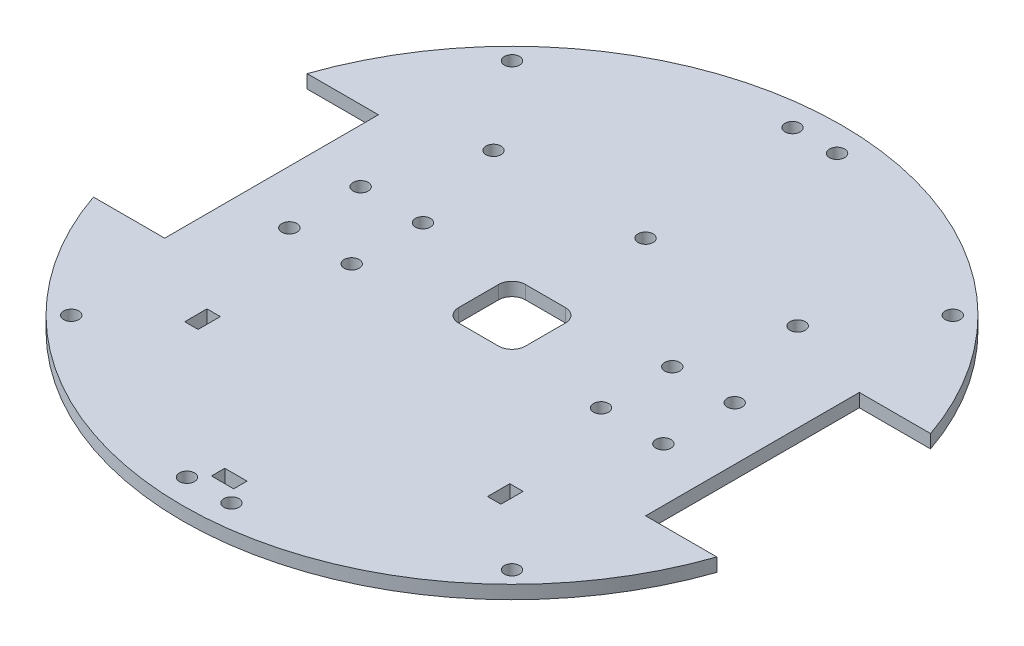
from build123d import *

# Parameters (mm, degrees)
SKETCH_1_R      = 1.7
SKETCH_1_W      = 3
SKETCH_1_H      = 5
SKETCH_1_W_2    = 5
SKETCH_1_H_2    = 3
EXTRUDE_1_DEPTH = 3


with BuildPart() as part:
    # 草图1 → 凸台-拉伸1 (new body)
    with BuildSketch(Plane(origin=(0, 0, 0), x_dir=(1, 0, 0), z_dir=(0, 1, 0))):
        with BuildLine():
            Line((54, 24), (70, 24))
            ThreePointArc((70, 24), (0, 74), (-70, 24))
            Line((-70, 24), (-54, 24))
            Line((-54, 24), (-54, -24))
            Line((-54, -24), (-70, -24))
            ThreePointArc((-70, -24), (0, -74), (70, -24))
            Line((70, -24), (54, -24))
            Line((54, -24), (54, 24))
        make_face()
        with Locations(Location((-49.497474683, -49.497474683, 0), (0, 0, 270))):
            Circle(SKETCH_1_R, mode=Mode.SUBTRACT)
        with Locations(Location((-5, -68, 0), (0, 0, 270))):
            Circle(SKETCH_1_R, mode=Mode.SUBTRACT)
        with Locations(Location((-42, -8, 0), (0, 0, 270))):
            Circle(SKETCH_1_R, mode=Mode.SUBTRACT)
        with Locations((-34, -35.5)):
            Rectangle(SKETCH_1_W, SKETCH_1_H, mode=Mode.SUBTRACT)
        with Locations(Location((-28, -8, 0), (0, 0, 270))):
            Circle(SKETCH_1_R, mode=Mode.SUBTRACT)
        with Locations(Location((5, -68, 0), (0, 0, 270))):
            Circle(SKETCH_1_R, mode=Mode.SUBTRACT)
        with Locations((0, -63.5)):
            Rectangle(SKETCH_1_W_2, SKETCH_1_H_2, mode=Mode.SUBTRACT)
        with Locations(Location((49.497474683, -49.497474683, 0), (0, 0, 270))):
            Circle(SKETCH_1_R, mode=Mode.SUBTRACT)
        with Locations((34, -35.5)):
            Rectangle(SKETCH_1_W, SKETCH_1_H, mode=Mode.SUBTRACT)
        with Locations(Location((28, -8, 0), (0, 0, 270))):
            Circle(SKETCH_1_R, mode=Mode.SUBTRACT)
        with Locations(Location((42, -8, 0), (0, 0, 270))):
            Circle(SKETCH_1_R, mode=Mode.SUBTRACT)
        with Locations(Location((-42, 8, 0), (0, 0, 270))):
            Circle(SKETCH_1_R, mode=Mode.SUBTRACT)
        with Locations(Location((-28, 8, 0), (0, 0, 270))):
            Circle(SKETCH_1_R, mode=Mode.SUBTRACT)
        with Locations(Location((-34.15, 30, 0), (0, 0, 270))):
            Circle(SKETCH_1_R, mode=Mode.SUBTRACT)
        with Locations(Location((0, 30, 0), (0, 0, 270))):
            Circle(SKETCH_1_R, mode=Mode.SUBTRACT)
        with Locations(Location((-49.497474683, 49.497474683, 0), (0, 0, 270))):
            Circle(SKETCH_1_R, mode=Mode.SUBTRACT)
        with Locations(Location((-5, 68, 0), (0, 0, 270))):
            Circle(SKETCH_1_R, mode=Mode.SUBTRACT)
        with BuildLine():
            Line((4.5, -7.5), (-4.5, -7.5))
            ThreePointArc((-4.5, -7.5), (-6.621320344, -6.621320344), (-7.5, -4.5))
            Line((-7.5, -4.5), (-7.5, 4.5))
            ThreePointArc((-7.5, 4.5), (-6.621320344, 6.621320344), (-4.5, 7.5))
            Line((-4.5, 7.5), (4.5, 7.5))
            ThreePointArc((4.5, 7.5), (6.621320344, 6.621320344), (7.5, 4.5))
            Line((7.5, 4.5), (7.5, -4.5))
            ThreePointArc((7.5, -4.5), (6.621320344, -6.621320344), (4.5, -7.5))
        make_face(mode=Mode.SUBTRACT)
        with Locations(Location((28, 8, 0), (0, 0, 270))):
            Circle(SKETCH_1_R, mode=Mode.SUBTRACT)
        with Locations(Location((34.15, 30, 0), (0, 0, 270))):
            Circle(SKETCH_1_R, mode=Mode.SUBTRACT)
        with Locations(Location((42, 8, 0), (0, 0, 270))):
            Circle(SKETCH_1_R, mode=Mode.SUBTRACT)
        with Locations(Location((5, 68, 0), (0, 0, 270))):
            Circle(SKETCH_1_R, mode=Mode.SUBTRACT)
        with Locations(Location((49.497474683, 49.497474683, 0), (0, 0, 270))):
            Circle(SKETCH_1_R, mode=Mode.SUBTRACT)
    extrude(amount=EXTRUDE_1_DEPTH)


solid = part.part
